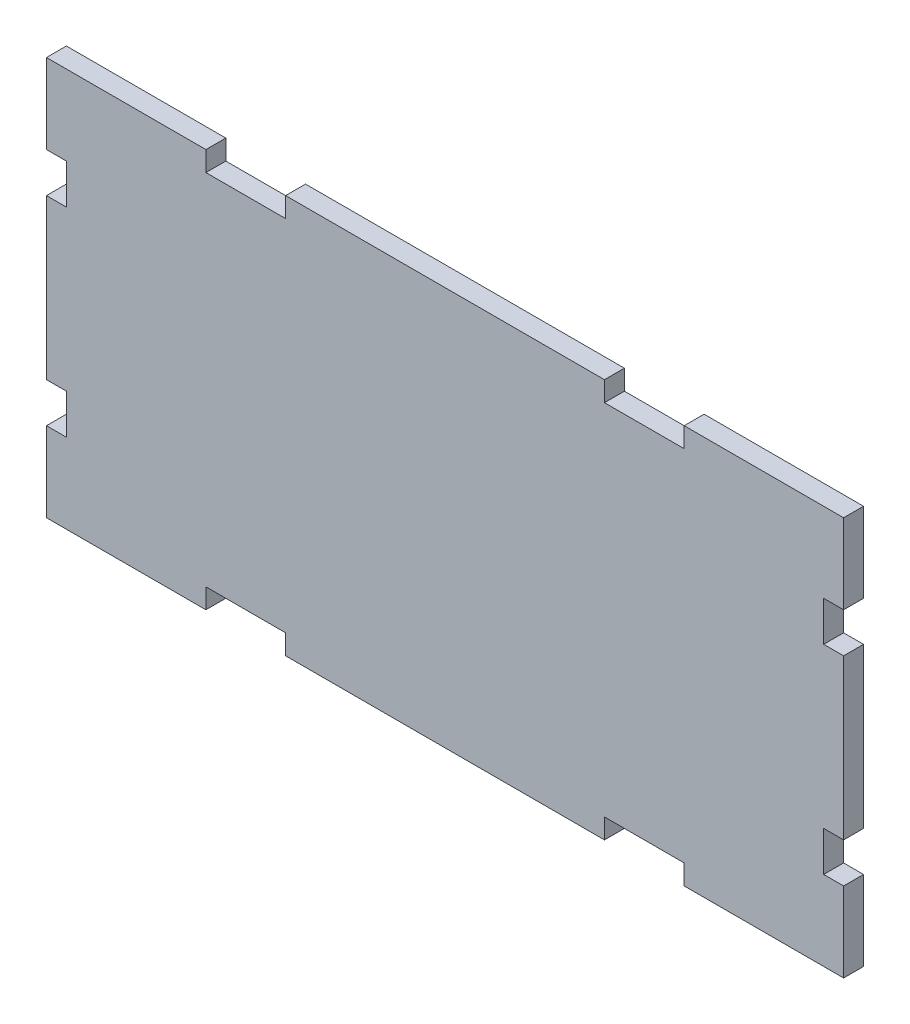
from build123d import *

# Parameters (mm, degrees)
BOSS_EXTRUDE1_DEPTH = 5


with BuildPart() as part:
    # Sketch1 → Boss-Extrude1 (new body)
    with BuildSketch(Plane.XY):
        Polygon((-105.777584558, 35.818003585), (-65.777584558, 35.818003585), (-65.777584558, 30.818003585), (-45.777584558, 30.818003585), (-45.777584558, 35.818003585), (34.222415442, 35.818003585), (34.222415442, 30.818003585), (54.222415442, 30.818003585), (54.222415442, 35.818003585), (94.222415442, 35.818003585), (94.222415442, 15.818003585), (89.222415442, 15.818003585), (89.222415442, 5.818003585), (94.222415442, 5.818003585), (94.222415442, -34.181996415), (89.222415442, -34.181996415), (89.222415442, -44.181996415), (94.222415442, -44.181996415), (94.222415442, -64.181996415), (54.222415442, -64.181996415), (54.222415442, -59.181996415), (34.222415442, -59.181996415), (34.222415442, -64.181996415), (-45.777584558, -64.181996415), (-45.777584558, -59.181996415), (-65.777584558, -59.181996415), (-65.777584558, -64.181996415), (-105.777584558, -64.181996415), (-105.777584558, -44.181996415), (-100.777584558, -44.181996415), (-100.777584558, -34.181996415), (-105.777584558, -34.181996415), (-105.777584558, 5.818003585), (-100.777584558, 5.818003585), (-100.777584558, 15.818003585), (-105.777584558, 15.818003585), align=None)
    extrude(amount=BOSS_EXTRUDE1_DEPTH)


solid = part.part
